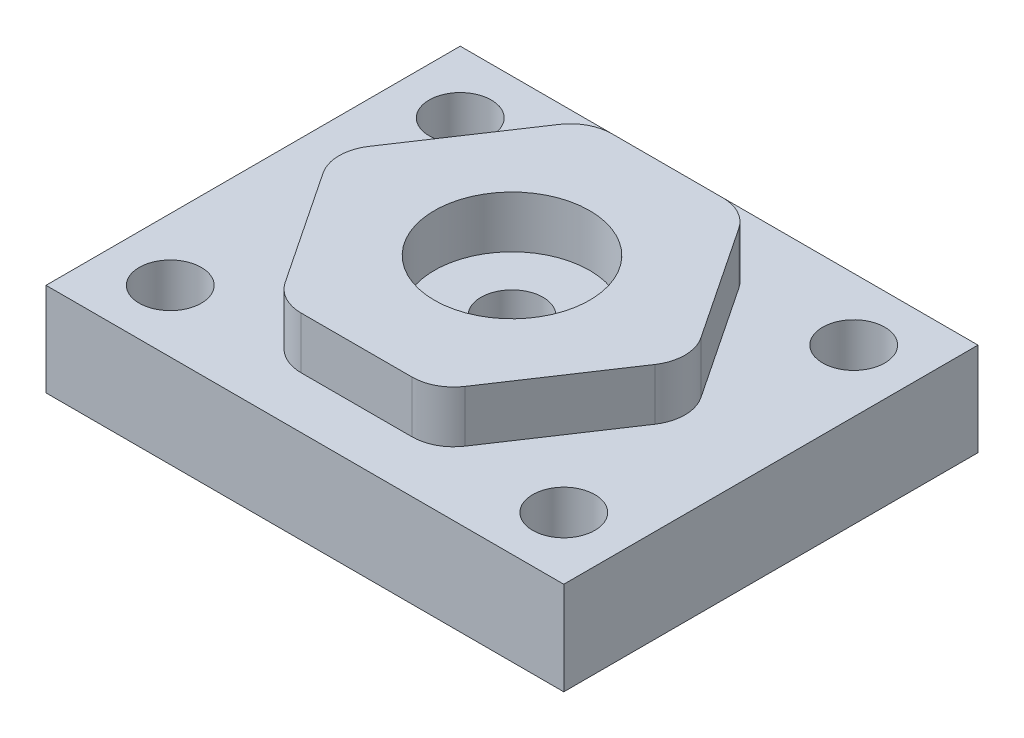
from build123d import *

# Parameters (mm, degrees)
SKETCH_2_W           = 50
SKETCH_2_H           = 40
EXTRUDE_1_DEPTH      = 9
EXTRUDE_3_DEPTH      = 5
SKETCH_6_R           = 7.5
CUT_EXTRUDE_1_DEPTH  = 5
SKETCH_7_R           = 3
CUT_EXTRUDE_2_DEPTH  = 34.256578297
CUT_EXTRUDE_START    = -5
CUT_EXTRUDE_11_DEPTH = 5
SKETCH_16_R          = 3
CUT_EXTRUDE_12_DEPTH = 34.256578297


with BuildPart() as part:
    # 草图2 → 凸台-拉伸1 (new body)
    with BuildSketch(Plane(origin=(0, 0, 0), x_dir=(1, 0, 0), z_dir=(0, 1, 0))):
        Rectangle(SKETCH_2_W, SKETCH_2_H)
    extrude(amount=EXTRUDE_1_DEPTH)

    # 草图3 → 凸台-拉伸3 (add)
    with BuildSketch(Plane(origin=(0, 9, 0), x_dir=(1, 0, 0), z_dir=(0, 1, 0))):
        with BuildLine():
            Line((13.5, -15), (-13.5, -15))
            ThreePointArc((-13.5, -15), (-16.328427125, -13.828427125), (-17.5, -11))
            Line((-17.5, -11), (-17.5, 11))
            ThreePointArc((-17.5, 11), (-16.328427125, 13.828427125), (-13.5, 15))
            Line((-13.5, 15), (13.5, 15))
            ThreePointArc((13.5, 15), (16.328427125, 13.828427125), (17.5, 11))
            Line((17.5, 11), (17.5, -11))
            ThreePointArc((17.5, -11), (16.328427125, -13.828427125), (13.5, -15))
        make_face()
    extrude(amount=EXTRUDE_3_DEPTH)

    # 草图6 → 切除-拉伸1 (cut)
    with BuildSketch(Plane(origin=(0, 14, 0), x_dir=(1, 0, 0), z_dir=(0, 1, 0))):
        with Locations(Location((0, 0, 0), (0, 0, 270))):
            Circle(SKETCH_6_R)
    extrude(amount=-CUT_EXTRUDE_1_DEPTH, mode=Mode.SUBTRACT)

    # 草图7 → 切除-拉伸2 (cut, through all)
    with BuildSketch(Plane(origin=(0, 9, 0), x_dir=(1, 0, 0), z_dir=(0, 1, 0))):
        with Locations(Location((0, 0, 0), (0, 0, 270))):
            Circle(SKETCH_7_R)
    extrude(amount=-CUT_EXTRUDE_2_DEPTH, mode=Mode.SUBTRACT)

    # 草图8 → 切除-拉伸11 (cut)
    with BuildSketch(Plane(origin=(0, 14, 0), x_dir=(1, 0, 0), z_dir=(0, 1, 0)).offset(CUT_EXTRUDE_START)):
        with BuildLine():
            ThreePointArc((-8.687466143, 13.218800785), (-7.246696668, 14.526698395), (-5.359264966, 15))
            Line((-5.359264966, 15), (-13.5, 15))
            ThreePointArc((-13.5, 15), (-16.328427125, 13.828427125), (-17.5, 11))
            Line((-17.5, 11), (-17.5, -11))
            ThreePointArc((-17.5, -11), (-16.328427125, -13.828427125), (-13.5, -15))
            Line((-13.5, -15), (-5.359264966, -15))
            ThreePointArc((-5.359264966, -15), (-7.246696668, -14.526698395), (-8.687466143, -13.218800785))
            Line((-8.687466143, -13.218800785), (-16.020799477, -2.218800785))
            ThreePointArc((-16.020799477, -2.218800785), (-16.692598299, 0), (-16.020799477, 2.218800785))
            Line((-16.020799477, 2.218800785), (-8.687466143, 13.218800785))
        make_face()
        with BuildLine():
            ThreePointArc((5.359264966, 15), (7.246696668, 14.526698395), (8.687466143, 13.218800785))
            Line((8.687466143, 13.218800785), (16.020799477, 2.218800785))
            ThreePointArc((16.020799477, 2.218800785), (16.692598299, 0), (16.020799477, -2.218800785))
            Line((16.020799477, -2.218800785), (8.687466143, -13.218800785))
            ThreePointArc((8.687466143, -13.218800785), (7.246696668, -14.526698395), (5.359264966, -15))
            Line((5.359264966, -15), (13.5, -15))
            ThreePointArc((13.5, -15), (16.328427125, -13.828427125), (17.5, -11))
            Line((17.5, -11), (17.5, 11))
            ThreePointArc((17.5, 11), (16.328427125, 13.828427125), (13.5, 15))
            Line((13.5, 15), (5.359264966, 15))
        make_face()
    extrude(amount=CUT_EXTRUDE_11_DEPTH, mode=Mode.SUBTRACT)

    # 草图16 → 切除-拉伸12 (cut, through all)
    with BuildSketch(Plane(origin=(0, 9, 0), x_dir=(1, 0, 0), z_dir=(0, 1, 0))):
        with Locations(Location((-19, 14, 0), (0, 0, 270))):
            Circle(SKETCH_16_R)
        with Locations(Location((-19, -14, 0), (0, 0, 90))):
            Circle(SKETCH_16_R)
        with Locations(Location((19, -14, 0), (0, 0, 270))):
            Circle(SKETCH_16_R)
        with Locations(Location((19, 14, 0), (0, 0, 90))):
            Circle(SKETCH_16_R)
    extrude(amount=-CUT_EXTRUDE_12_DEPTH, mode=Mode.SUBTRACT)


solid = part.part
